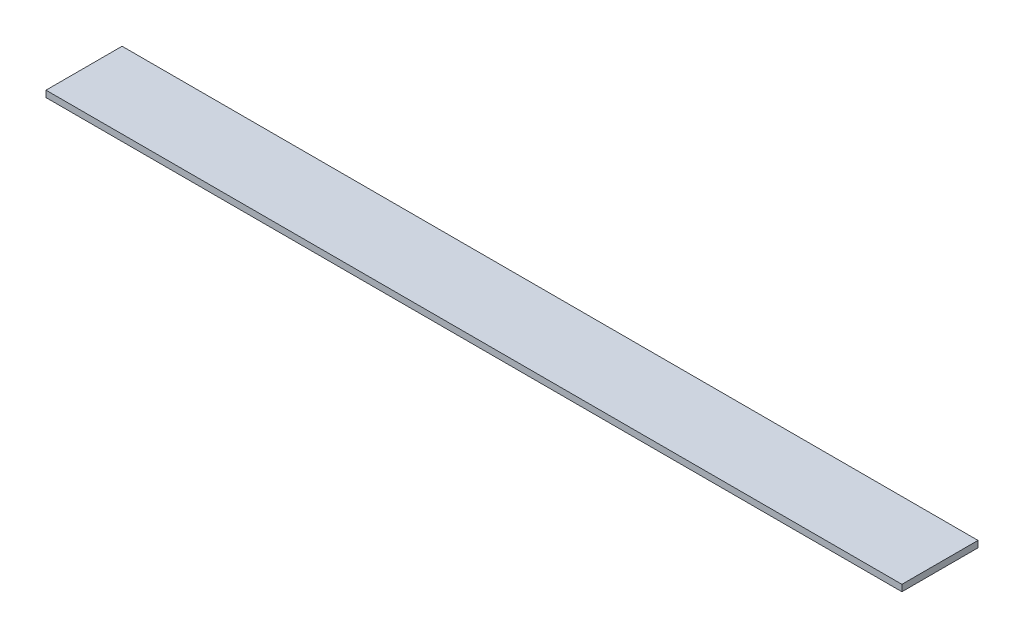
from build123d import *

# Parameters (mm, degrees)
SKETCH1_W           = 225
SKETCH1_H           = 20
BOSS_EXTRUDE1_DEPTH = 1.7


with BuildPart() as part:
    # Sketch1 → Boss-Extrude1 (new body)
    with BuildSketch(Plane(origin=(0, 0, 0), x_dir=(1, 0, 0), z_dir=(0, 1, 0))):
        Rectangle(SKETCH1_W, SKETCH1_H)
    extrude(amount=BOSS_EXTRUDE1_DEPTH)


solid = part.part
